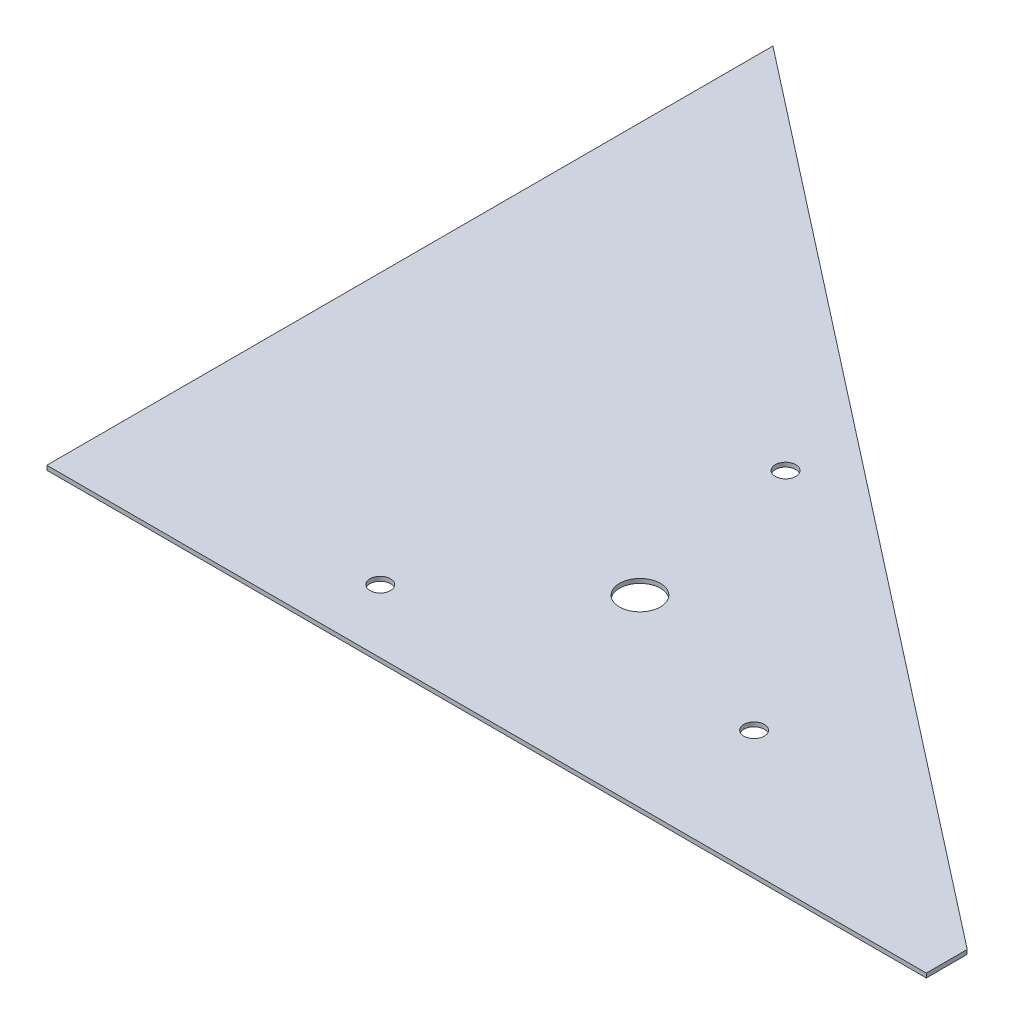
from build123d import *

# Parameters (mm, degrees)
BOSS_EXTRUDE1_DEPTH = 2.65684
SKETCH2_R           = 12.7
CUT_EXTRUDE1_DEPTH  = 709.165228812
SKETCH3_R           = 6.35
CUT_EXTRUDE2_DEPTH  = 709.165228812


with BuildPart() as part:
    # Sketch1 → Boss-Extrude1 (new body)
    with BuildSketch(Plane(origin=(0, 0, 0), x_dir=(1, 0, 0), z_dir=(0, 1, 0))):
        Polygon((0, 450.85), (0, 0), (546.1, 0), (546.1, 25.4), align=None)
    extrude(amount=BOSS_EXTRUDE1_DEPTH)

    # Sketch2 → Cut-Extrude1 (cut, through all)
    with BuildSketch(Plane.XZ):
        with Locations(Location((254, -114.3, 0), (0, 0, 270))):
            Circle(SKETCH2_R)
    extrude(amount=-CUT_EXTRUDE1_DEPTH, mode=Mode.SUBTRACT)

    # Sketch3 → Cut-Extrude2 (cut, through all)
    with BuildSketch(Plane(origin=(0, 2.65684, 0), x_dir=(1, 0, 0), z_dir=(0, 1, 0))):
        with Locations(Location((362.072773191, 77.087559946, 0), (0, 0, 270))):
            Circle(SKETCH3_R)
        with Locations(Location((167.736694981, 39.312452986, 0), (0, 0, 270))):
            Circle(SKETCH3_R)
        with Locations(Location((232.190531828, 226.499987068, 0), (0, 0, 270))):
            Circle(SKETCH3_R)
    extrude(amount=-CUT_EXTRUDE2_DEPTH, mode=Mode.SUBTRACT)


solid = part.part
